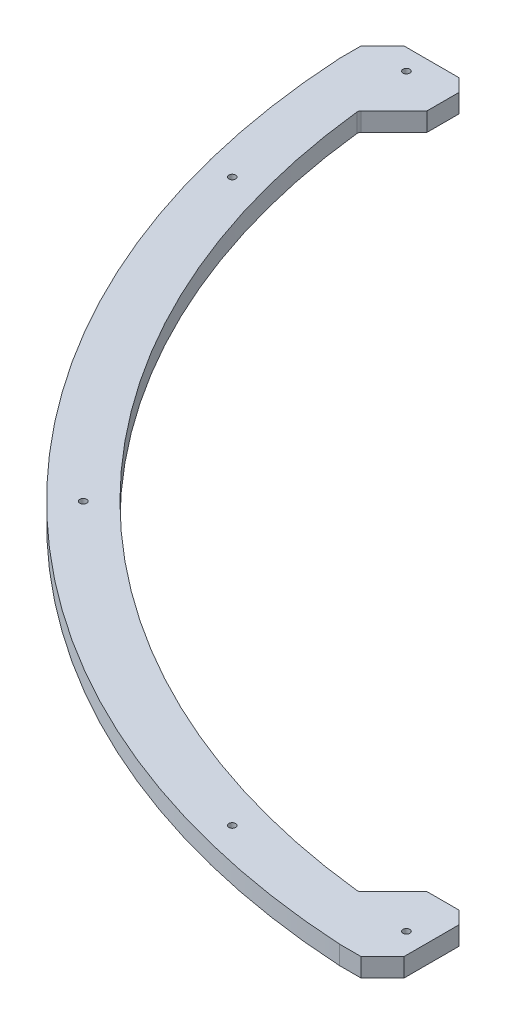
from build123d import *

# Parameters (mm, degrees)
SKETCH1_R               = 796.925
SKETCH1_R_2             = 746.125
BOSS_EXTRUDE1_DEPTH     = 18.25625
CUT_EXTRUDE2_DEPTH      = 1128.169996901
SKETCH4_W               = 88.9
SKETCH4_H               = 44.45
SKETCH4_W_2             = 44.45
SKETCH4_H_2             = 88.9
BOSS_EXTRUDE2_DEPTH     = 18.25625
SKETCH10_W              = 88.9
SKETCH10_H              = 1.5875
SKETCH10_W_2            = 1.5875
SKETCH10_H_2            = 88.9
CUT_EXTRUDE3_DEPTH      = 1128.169996901
SKETCH11_W              = 1.240607087
SKETCH11_H              = 42.8625
SKETCH11_W_2            = 42.8625
SKETCH11_H_2            = 1.240607087
CUT_EXTRUDE4_DEPTH      = 1128.169996901
BOSS_EXTRUDE4_DEPTH     = 18.25625
CUT_EXTRUDE5_DEPTH      = 1126.415744032
F_1_4_CLEARANCE_HOLE3_D = 6.7564
F_1_4_CLEARANCE_HOLE1_D = 6.7564
CUT_EXTRUDE6_DEPTH      = 1126.415744032
FILLET4_R               = 3.3782


with BuildPart() as part:
    # Sketch1 → Boss-Extrude1 (new body)
    with BuildSketch(Plane(origin=(0, 0, 0), x_dir=(1, 0, 0), z_dir=(0, 1, 0))):
        with Locations(Location((0, 0, 0), (0, 0, 270))):
            Circle(SKETCH1_R)
        with Locations(Location((0, 0, 0), (0, 0, 270))):
            Circle(SKETCH1_R_2, mode=Mode.SUBTRACT)
    extrude(amount=BOSS_EXTRUDE1_DEPTH)

    # Sketch3 → Cut-Extrude2 (cut, through all)
    with BuildSketch(Plane(origin=(0, 18.25625, 0), x_dir=(1, 0, 0), z_dir=(0, 1, 0))):
        with BuildLine():
            Line((-796.925, 0), (0, 0))
            Line((0, 0), (0, -796.925))
            ThreePointArc((0, -796.925), (563.511071597, 563.511071597), (-796.925, 0))
        make_face()
    extrude(amount=-CUT_EXTRUDE2_DEPTH, mode=Mode.SUBTRACT)

    # Sketch4 → Boss-Extrude2 (add)
    with BuildSketch(Plane(origin=(0, 18.25625, 0), x_dir=(1, 0, 0), z_dir=(0, 1, 0))):
        with Locations((-752.475, -22.225)):
            Rectangle(SKETCH4_W, SKETCH4_H)
        with Locations((-22.225, -752.475)):
            Rectangle(SKETCH4_W_2, SKETCH4_H_2)
    extrude(amount=-BOSS_EXTRUDE2_DEPTH)

    # Sketch10 → Cut-Extrude3 (cut, through all)
    with BuildSketch(Plane(origin=(0, 18.25625, 0), x_dir=(1, 0, 0), z_dir=(0, 1, 0))):
        with Locations((-752.475, -0.79375)):
            Rectangle(SKETCH10_W, SKETCH10_H)
        with Locations((-0.79375, -752.475)):
            Rectangle(SKETCH10_W_2, SKETCH10_H_2)
    extrude(amount=-CUT_EXTRUDE3_DEPTH, mode=Mode.SUBTRACT)

    # Sketch11 → Cut-Extrude4 (cut, through all)
    with BuildSketch(Plane(origin=(0, 18.25625, 0), x_dir=(1, 0, 0), z_dir=(0, 1, 0))):
        with Locations((-796.304696457, -23.01875)):
            Rectangle(SKETCH11_W, SKETCH11_H)
        with Locations((-23.01875, -796.304696457)):
            Rectangle(SKETCH11_W_2, SKETCH11_H_2)
    extrude(amount=-CUT_EXTRUDE4_DEPTH, mode=Mode.SUBTRACT)

    # Sketch12 → Boss-Extrude4 (add, through all)
    with BuildSketch(Plane(origin=(0, 18.25625, 0), x_dir=(1, 0, 0), z_dir=(0, 1, 0))):
        with BuildLine():
            Line((-45.731111071, -708.025), (-79.575539683, -741.869428612))
            ThreePointArc((-79.575539683, -741.869428612), (-62.030076286, -743.542053458), (-44.45, -744.799780562))
            Line((-44.45, -744.799780562), (-44.45, -708.025))
            Line((-44.45, -708.025), (-45.731111071, -708.025))
        make_face()
        with BuildLine():
            Line((-708.025, -45.731111071), (-741.869428612, -79.575539683))
            ThreePointArc((-741.869428612, -79.575539683), (-743.542053458, -62.030076286), (-744.799780562, -44.45))
            Line((-744.799780562, -44.45), (-708.025, -44.45))
            Line((-708.025, -44.45), (-708.025, -45.731111071))
        make_face()
    extrude(amount=-BOSS_EXTRUDE4_DEPTH)

    # Sketch14 → Cut-Extrude5 (cut, through all)
    with BuildSketch(Plane.XZ):
        Polygon((-166.462625141, 960.559518053), (42.242196456, 751.854696456), (-751.854696456, -42.242196456), (-960.559518053, 166.462625141), (-949.662084803, 177.360058391), (-747.606322079, -24.695704333), (24.695704333, 747.606322079), (-177.360058391, 949.662084803), align=None)
    extrude(amount=-CUT_EXTRUDE5_DEPTH, mode=Mode.SUBTRACT)

    # 1/4 Clearance Hole3 (through all)
    with Locations(Plane(origin=(0, 18.25625, 0), x_dir=(1, 0, 0), z_dir=(0, 1, 0))):
        with Locations((-752.09645014, -22.450640303), (-22.450640303, -752.09645014)):
            Hole(F_1_4_CLEARANCE_HOLE3_D / 2)

    # 1/4 Clearance Hole1 (through all)
    with Locations(Plane(origin=(0, 18.25625, 0), x_dir=(1, 0, 0), z_dir=(0, 1, 0))):
        with Locations((-747.606322079, -197.565634664), (-545.550559355, -545.550559355), (-197.565634664, -747.606322079)):
            Hole(F_1_4_CLEARANCE_HOLE1_D / 2)

    # Sketch19 → Cut-Extrude6 (cut, through all)
    with BuildSketch(Plane(origin=(0, 18.25625, 0), x_dir=(1, 0, 0), z_dir=(0, 1, 0))):
        Polygon((-774.547090442, -2.24506403), (-720.665553716, -2.24506403), (-747.606322079, 24.695704333), align=None)
        Polygon((-708.317701549, -14.592916197), (-708.025, -14.885617746), (-708.025, -45.731111071), (-708.317701549, -46.02381262), align=None)
        Polygon((-14.885617746, -708.025), (-45.731111071, -708.025), (-46.02381262, -708.317701549), (-14.592916197, -708.317701549), align=None)
        Polygon((24.695704333, -747.606322079), (-2.24506403, -774.547090442), (-2.24506403, -720.665553716), align=None)
    extrude(amount=-CUT_EXTRUDE6_DEPTH, mode=Mode.SUBTRACT)

    # Fillet4
    fillet4_edges = [part.edges().sort_by_distance(p)[0] for p in [
        (-79.575539683, 9.128125, 741.869428612),
        (-741.869428612, 9.128125, 79.575539683),
    ]]
    fillet(fillet4_edges, radius=FILLET4_R)


solid = part.part
